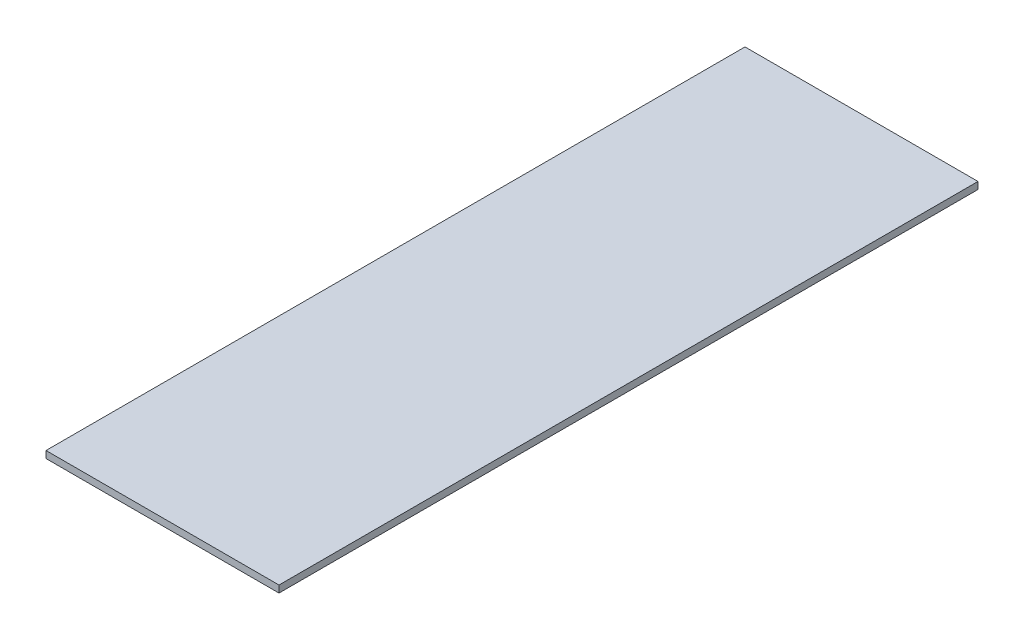
from build123d import *

# Parameters (mm, degrees)
SKETCH1_W           = 100
SKETCH1_H           = 300
BOSS_EXTRUDE1_DEPTH = 3


with BuildPart() as part:
    # Sketch1 → Boss-Extrude1 (new body)
    with BuildSketch(Plane(origin=(0, 0, 0), x_dir=(1, 0, 0), z_dir=(0, 1, 0))):
        Rectangle(SKETCH1_W, SKETCH1_H)
    extrude(amount=BOSS_EXTRUDE1_DEPTH)


solid = part.part
